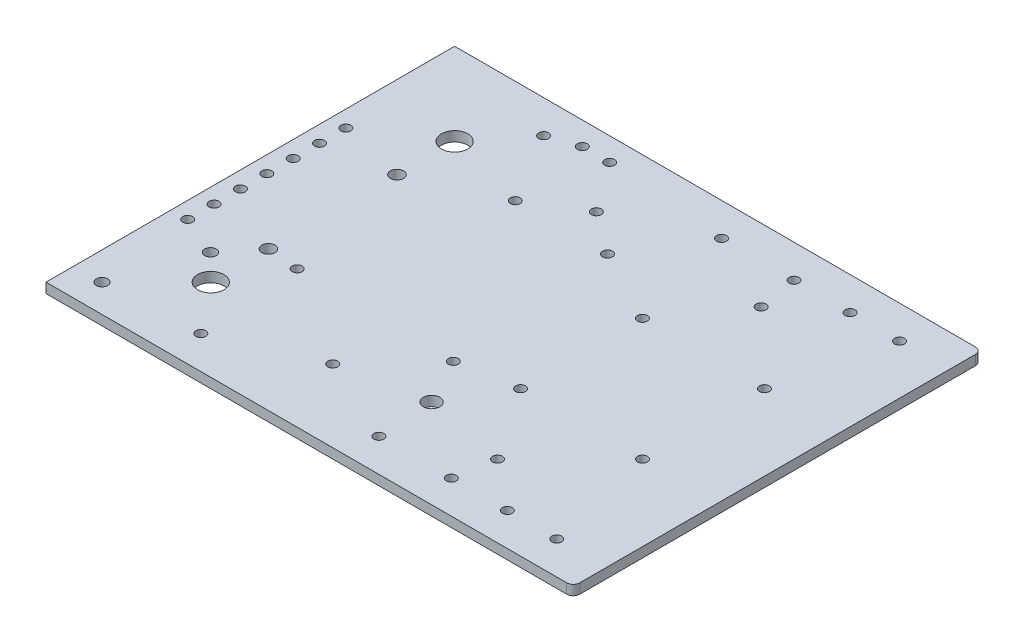
from build123d import *

# Parameters (mm, degrees)
SKETCH_1_W             = 160
SKETCH_1_H             = 124
EXTRUDE_1_DEPTH        = 3
SKETCH_2_R             = 1.5
CUT_EXTRUDE_1_DEPTH    = 10
SKETCH_3_R             = 2
CUT_EXTRUDE_2_DEPTH    = 172.618763543
SKETCH_4_R             = 1.5
CUT_EXTRUDE_3_DEPTH    = 10
PATTERN_LINEAR_1_COUNT = 7
PATTERN_LINEAR_1_PITCH = 8
SKETCH_6_R             = 1.5
CUT_EXTRUDE_4_DEPTH    = 10
SKETCH_7_R             = 1.5
CUT_EXTRUDE_5_DEPTH    = 10
SKETCH_8_R             = 1.5
CUT_EXTRUDE_6_DEPTH    = 10
SKETCH_9_R             = 1.5
CUT_EXTRUDE_7_DEPTH    = 10
SKETCH_10_R            = 4
CUT_EXTRUDE_8_DEPTH    = 10
FILLET_1_R             = 2
SKETCH_12_R            = 1.5
CUT_EXTRUDE_10_DEPTH   = 10
SKETCH_13_R            = 1.75
CUT_EXTRUDE_11_DEPTH   = 70
SKETCH_14_R            = 1.5
CUT_EXTRUDE_12_DEPTH   = 4
SKETCH_15_R            = 2.5
CUT_EXTRUDE_13_DEPTH   = 10


with BuildPart() as part:
    # 草圖1 → 填料-伸長1 (new body)
    with BuildSketch(Plane(origin=(0, 0, 0), x_dir=(1, 0, 0), z_dir=(0, 1, 0))):
        with Locations((80, 0)):
            Rectangle(SKETCH_1_W, SKETCH_1_H)
    extrude(amount=EXTRUDE_1_DEPTH)

    # 草圖2 → 除料-伸長1 (cut)
    with BuildSketch(Plane(origin=(0, 3, 0), x_dir=(1, 0, 0), z_dir=(0, 1, 0))):
        with Locations(Location((113, 52, 0), (0, 0, 270))):
            Circle(SKETCH_2_R)
        with Locations(Location((130, 52, 0), (0, 0, 270))):
            Circle(SKETCH_2_R)
        with Locations(Location((113, -52, 0), (0, 0, 270))):
            Circle(SKETCH_2_R)
        with Locations(Location((130, -52, 0), (0, 0, 270))):
            Circle(SKETCH_2_R)
    extrude(amount=-CUT_EXTRUDE_1_DEPTH, mode=Mode.SUBTRACT)

    # 草圖3 → 除料-伸長2 (cut, through all)
    with BuildSketch(Plane.XZ):
        with Locations(Location((25, 19.5, 0), (0, 0, 270))):
            Circle(SKETCH_3_R)
        with Locations(Location((25, -19.5, 0), (0, 0, 270))):
            Circle(SKETCH_3_R)
    extrude(amount=-CUT_EXTRUDE_2_DEPTH, mode=Mode.SUBTRACT)

    # 草圖4 → 除料-伸長3 (cut)
    with BuildSketch(Plane(origin=(0, 3, 0), x_dir=(1, 0, 0), z_dir=(0, 1, 0))):
        with Locations(Location((5, 24, 0), (0, 0, 270))):
            Circle(SKETCH_4_R)
    cut_extrude_3 = extrude(amount=-CUT_EXTRUDE_3_DEPTH, mode=Mode.SUBTRACT)

    # 直線複製排列1: 除料-伸長3 ×7
    with Locations(*[(0, 0, i * PATTERN_LINEAR_1_PITCH) for i in range(1, PATTERN_LINEAR_1_COUNT)]):
        add(cut_extrude_3, mode=Mode.SUBTRACT)

    # 草圖6 → 除料-伸長4 (cut)
    with BuildSketch(Plane(origin=(0, 3, 0), x_dir=(1, 0, 0), z_dir=(0, 1, 0))):
        with Locations(Location((100, 19, 0), (0, 0, 270))):
            Circle(SKETCH_6_R)
        with Locations(Location((137, 19, 0), (0, 0, 270))):
            Circle(SKETCH_6_R)
        with Locations(Location((100, -18, 0), (0, 0, 270))):
            Circle(SKETCH_6_R)
        with Locations(Location((137, -18, 0), (0, 0, 270))):
            Circle(SKETCH_6_R)
    extrude(amount=-CUT_EXTRUDE_4_DEPTH, mode=Mode.SUBTRACT)

    # 草圖7 → 除料-伸長5 (cut)
    with BuildSketch(Plane(origin=(0, 3, 0), x_dir=(1, 0, 0), z_dir=(0, 1, 0))):
        with Locations(Location((49.8, 30.6, 0), (0, 0, 270))):
            Circle(SKETCH_7_R)
        with Locations(Location((77.8, 30.6, 0), (0, 0, 270))):
            Circle(SKETCH_7_R)
        with Locations(Location((34.6, -20.4, 0), (0, 0, 270))):
            Circle(SKETCH_7_R)
        with Locations(Location((82.6, -21, 0), (0, 0, 270))):
            Circle(SKETCH_7_R)
    extrude(amount=-CUT_EXTRUDE_5_DEPTH, mode=Mode.SUBTRACT)

    # 草圖8 → 除料-伸長6 (cut)
    with BuildSketch(Plane(origin=(0, 3, 0), x_dir=(1, 0, 0), z_dir=(0, 1, 0))):
        with Locations(Location((37, 52, 0), (0, 0, 270))):
            Circle(SKETCH_8_R)
        with Locations(Location((145, 52, 0), (0, 0, 270))):
            Circle(SKETCH_8_R)
        with Locations(Location((37, -52, 0), (0, 0, 270))):
            Circle(SKETCH_8_R)
        with Locations(Location((145, -52, 0), (0, 0, 270))):
            Circle(SKETCH_8_R)
    extrude(amount=-CUT_EXTRUDE_6_DEPTH, mode=Mode.SUBTRACT)

    # 草圖9 → 除料-伸長7 (cut)
    with BuildSketch(Plane(origin=(0, 3, 0), x_dir=(1, 0, 0), z_dir=(0, 1, 0))):
        with Locations(Location((91, -52, 0), (0, 0, 270))):
            Circle(SKETCH_9_R)
        with Locations(Location((91, 52, 0), (0, 0, 270))):
            Circle(SKETCH_9_R)
    extrude(amount=-CUT_EXTRUDE_7_DEPTH, mode=Mode.SUBTRACT)

    # 草圖10 → 除料-伸長8 (cut)
    with BuildSketch(Plane(origin=(0, 3, 0), x_dir=(1, 0, 0), z_dir=(0, 1, 0))):
        with Locations(Location((25, 37, 0), (0, 0, 270))):
            Circle(SKETCH_10_R)
        with Locations(Location((25, -37, 0), (0, 0, 270))):
            Circle(SKETCH_10_R)
    extrude(amount=-CUT_EXTRUDE_8_DEPTH, mode=Mode.SUBTRACT)

    # 圓角1
    fillet_1_edges = [part.edges().sort_by_distance(p)[0] for p in [
        (160, 1.5, -62),
        (160, 1.5, 62),
    ]]
    fillet(fillet_1_edges, radius=FILLET_1_R)

    # 草圖12 → 除料-伸長10 (cut)
    with BuildSketch(Plane.XZ):
        with Locations(Location((65, 40, 0), (0, 0, 270))):
            Circle(SKETCH_12_R)
        with Locations(Location((115, 40, 0), (0, 0, 270))):
            Circle(SKETCH_12_R)
        with Locations(Location((65, -40, 0), (0, 0, 270))):
            Circle(SKETCH_12_R)
        with Locations(Location((115, -40, 0), (0, 0, 270))):
            Circle(SKETCH_12_R)
    extrude(amount=-CUT_EXTRUDE_10_DEPTH, mode=Mode.SUBTRACT)

    # 草圖13 → 除料-伸長11 (cut)
    with BuildSketch(Plane.XZ):
        with Locations(Location((8.5, 53.5, 0), (0, 0, 270))):
            Circle(SKETCH_13_R)
        with Locations(Location((17.1, 29.2, 0), (0, 0, 270))):
            Circle(SKETCH_13_R)
    extrude(amount=-CUT_EXTRUDE_11_DEPTH, mode=Mode.SUBTRACT)

    # 草圖14 → 除料-伸長12 (cut)
    with BuildSketch(Plane.XZ):
        with Locations(Location((54.05, -55, 0), (0, 0, 270))):
            Circle(SKETCH_14_R)
        with Locations(Location((45.75, -55, 0), (0, 0, 270))):
            Circle(SKETCH_14_R)
    extrude(amount=-CUT_EXTRUDE_12_DEPTH, mode=Mode.SUBTRACT)

    # 草圖15 → 除料-伸長13 (cut)
    with BuildSketch(Plane.XZ):
        with Locations(Location((90, 35, 0), (0, 0, 270))):
            Circle(SKETCH_15_R)
    extrude(amount=-CUT_EXTRUDE_13_DEPTH, mode=Mode.SUBTRACT)


solid = part.part
